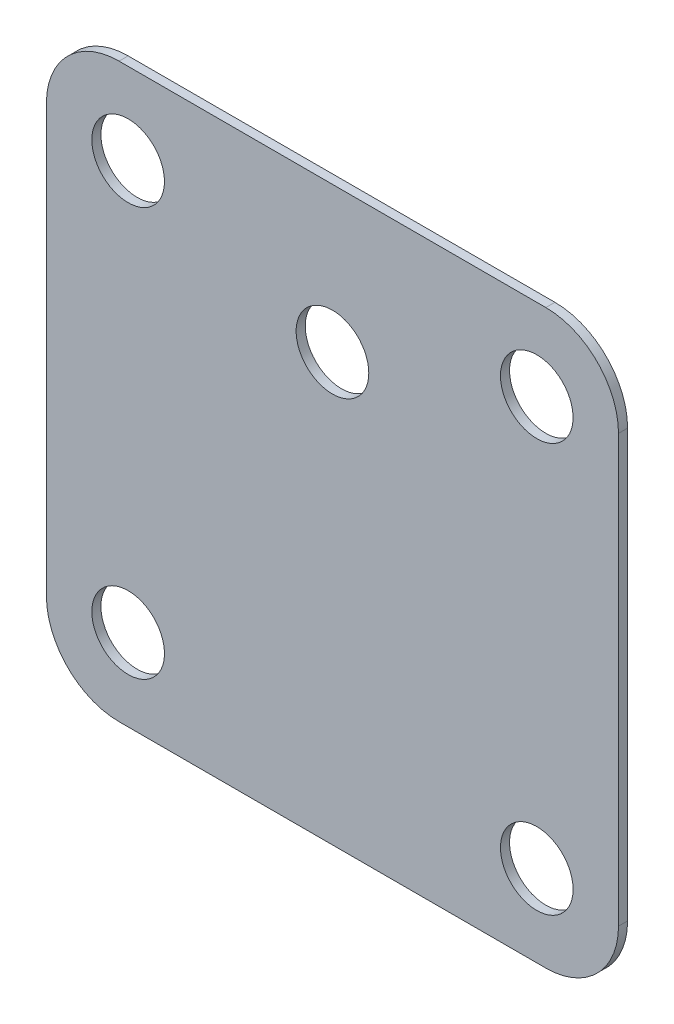
from build123d import *

# Parameters (mm, degrees)
SKETCH_1_R      = 4
EXTRUDE_1_DEPTH = 1


with BuildPart() as part:
    # 草图1 → 凸台-拉伸1 (new body)
    with BuildSketch(Plane.XY):
        with BuildLine():
            Line((-23.5, 31.5), (23.5, 31.5))
            ThreePointArc((23.5, 31.5), (29.156854249, 29.156854249), (31.5, 23.5))
            Line((31.5, 23.5), (31.5, -23.5))
            ThreePointArc((31.5, -23.5), (29.156854249, -29.156854249), (23.5, -31.5))
            Line((23.5, -31.5), (-23.5, -31.5))
            ThreePointArc((-23.5, -31.5), (-29.156854249, -29.156854249), (-31.5, -23.5))
            Line((-31.5, -23.5), (-31.5, 23.5))
            ThreePointArc((-31.5, 23.5), (-29.156854249, 29.156854249), (-23.5, 31.5))
        make_face()
        with Locations((-22.5, 22.5)):
            Circle(SKETCH_1_R, mode=Mode.SUBTRACT)
        with Locations(Location((22.5, 22.5, 0), (0, 0, 180))):
            Circle(SKETCH_1_R, mode=Mode.SUBTRACT)
        with Locations((22.5, -22.5)):
            Circle(SKETCH_1_R, mode=Mode.SUBTRACT)
        with Locations(Location((-22.5, -22.5, 0), (0, 0, 180))):
            Circle(SKETCH_1_R, mode=Mode.SUBTRACT)
        with Locations((0, 15.5)):
            Circle(SKETCH_1_R, mode=Mode.SUBTRACT)
    extrude(amount=EXTRUDE_1_DEPTH)


solid = part.part
